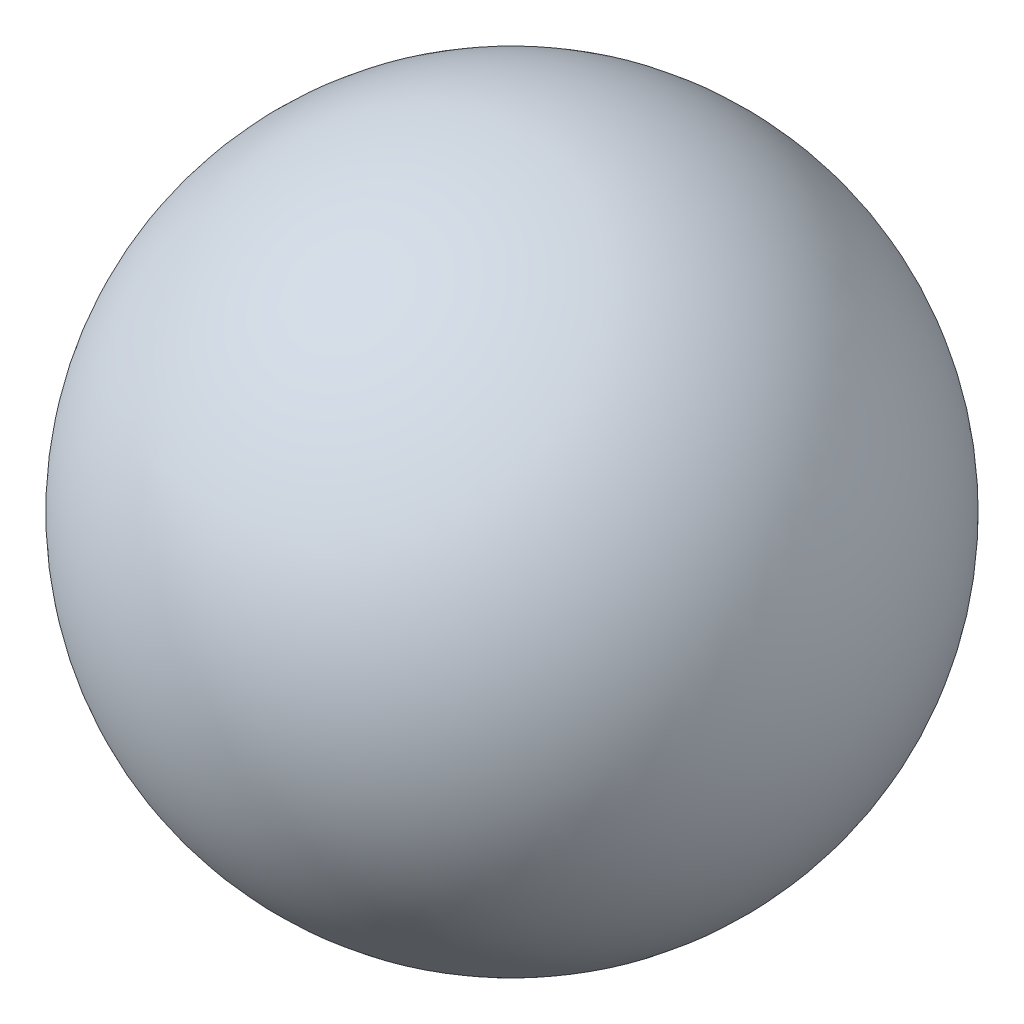
from build123d import *


with BuildPart() as part:
    # Sketch1 → Revolve3 (revolve)
    with BuildSketch(Plane.XY):
        with BuildLine():
            Line((0, 786.18), (0, 785))
            ThreePointArc((0, 785), (-785, 0), (0, -785))
            Line((0, -785), (0, -786.18))
            ThreePointArc((0, -786.18), (-786.18, 0), (0, 786.18))
        make_face()
    revolve(axis=Axis((0, 0, 0), (0, 1, 0)))


solid = part.part
